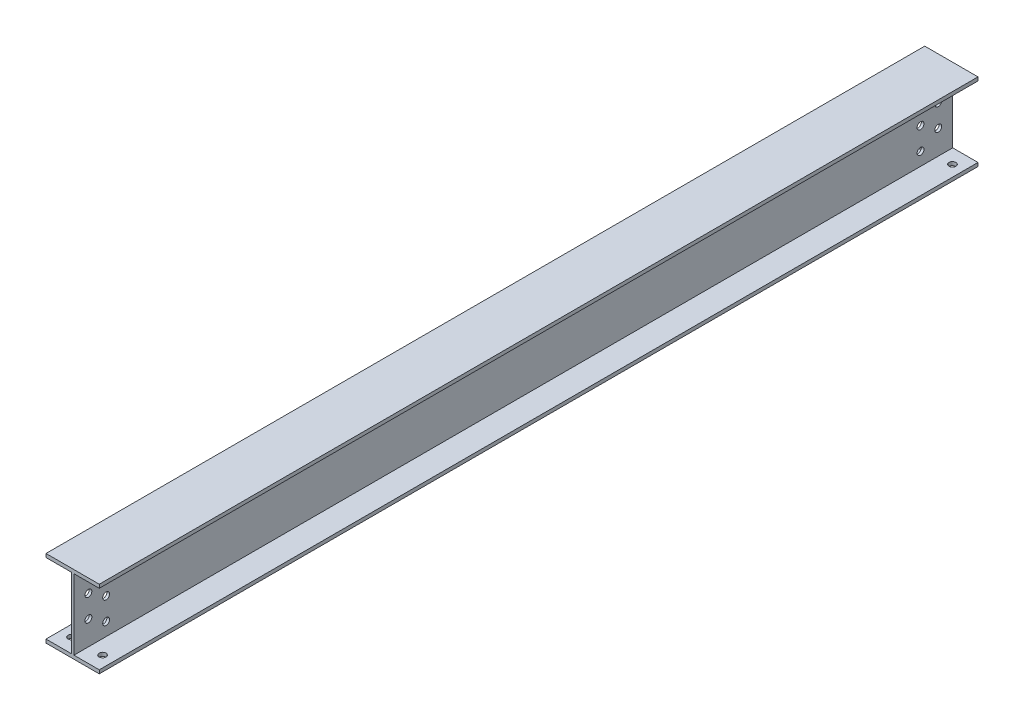
from build123d import *

# Parameters (mm, degrees)
EXTRUDE_1_DEPTH          = 1980
CUT_EXTRUDE_2_DEPTH      = 1992.337490231
CUT_EXTRUDE_2_DEPTH_BACK = 1992.337490231
SKETCH_2_R               = 15.5
SKETCH_5_R               = 15.5
CUT_EXTRUDE_4_DEPTH      = 2012.555616929


with BuildPart() as part:
    # 草图1 → 拉伸1 (new, symmetric)
    with BuildSketch(Plane.XY):
        Polygon((-6, 159), (-120, 159), (-120, 175), (120, 175), (120, 159), (6, 159), (6, -159), (120, -159), (120, -175), (-120, -175), (-120, -159), (-6, -159), align=None)
    extrude(amount=EXTRUDE_1_DEPTH, both=True)

    # 草图2 → 拉伸2 (cut, two sides: drawn at the far end of the back side and taken through both)
    with BuildSketch(Plane(origin=(0, 0, 0), x_dir=(0, 0, -1), z_dir=(1, 0, 0)).offset(-CUT_EXTRUDE_2_DEPTH_BACK)):
        with Locations(Location((-1915, 50, 0), (0, 0, 270))):
            Circle(SKETCH_2_R)
        with Locations(Location((-1835, 0, 0), (0, 0, 270))):
            Circle(SKETCH_2_R)
        with Locations(Location((-1835, 100, 0), (0, 0, 270))):
            Circle(SKETCH_2_R)
        with Locations(Location((-1835, -100, 0), (0, 0, 270))):
            Circle(SKETCH_2_R)
        with Locations(Location((-1915, -50, 0), (0, 0, 270))):
            Circle(SKETCH_2_R)
        with Locations(Location((1915, -50, 0), (0, 0, 270))):
            Circle(SKETCH_2_R)
        with Locations(Location((1835, -100, 0), (0, 0, 270))):
            Circle(SKETCH_2_R)
        with Locations(Location((1835, 100, 0), (0, 0, 270))):
            Circle(SKETCH_2_R)
        with Locations(Location((1835, 0, 0), (0, 0, 270))):
            Circle(SKETCH_2_R)
        with Locations(Location((1915, 50, 0), (0, 0, 270))):
            Circle(SKETCH_2_R)
    extrude(amount=CUT_EXTRUDE_2_DEPTH + CUT_EXTRUDE_2_DEPTH_BACK, mode=Mode.SUBTRACT)

    # 草图5 → 拉伸4 (cut, through all)
    with BuildSketch(Plane(origin=(0, -159, 0), x_dir=(1, 0, 0), z_dir=(0, 1, 0))):
        with Locations(Location((-70, 1915, 0), (0, 0, 270))):
            Circle(SKETCH_5_R)
        with Locations(Location((70, 1915, 0), (0, 0, 270))):
            Circle(SKETCH_5_R)
        with Locations(Location((70, -1915, 0), (0, 0, 90))):
            Circle(SKETCH_5_R)
        with Locations(Location((-70, -1915, 0), (0, 0, 90))):
            Circle(SKETCH_5_R)
    extrude(amount=-CUT_EXTRUDE_4_DEPTH, mode=Mode.SUBTRACT)


solid = part.part
